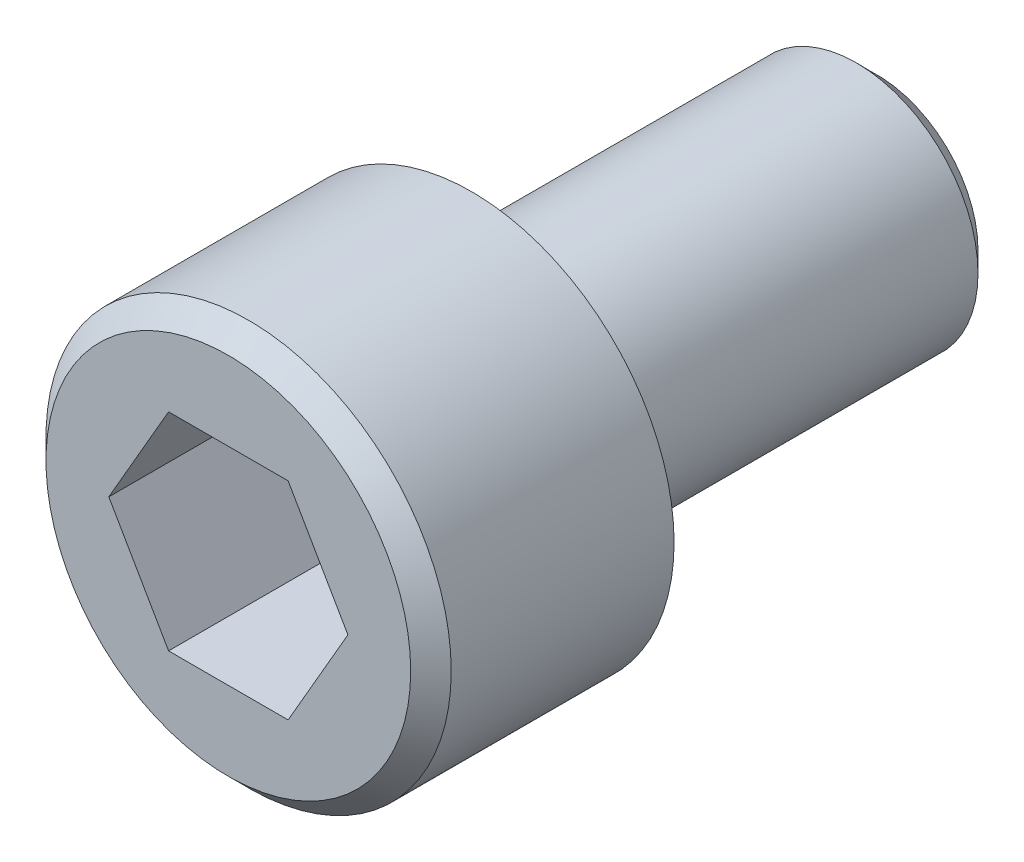
from build123d import *

# Parameters (mm, degrees)
CROQUIS1_R              = 5
SALIENTE_EXTRUIR1_DEPTH = 6
CROQUIS2_R              = 3
SALIENTE_EXTRUIR2_DEPTH = 10
CHAFL_N1_SIZE           = 0.5
CORTAR_EXTRUIR1_DEPTH   = 4


with BuildPart() as part:
    # Croquis1 → Saliente-Extruir1 (new body)
    with BuildSketch(Plane.XY):
        Circle(CROQUIS1_R)
    extrude(amount=SALIENTE_EXTRUIR1_DEPTH)

    # Croquis2 → Saliente-Extruir2 (add)
    with BuildSketch(Plane(origin=(0, 0, 0), x_dir=(-1, 0, 0), z_dir=(0, 0, -1))):
        with Locations(Location((0, 0, 0), (0, 0, 180))):
            Circle(CROQUIS2_R)
    extrude(amount=SALIENTE_EXTRUIR2_DEPTH)

    # Chaflán1
    chafl_n1_edges = [part.edges().sort_by_distance(p)[0] for p in [
        (-5, 0, 6),
        (-3, 0, -10),
    ]]
    chamfer(chafl_n1_edges, length=CHAFL_N1_SIZE)

    # Croquis3 → Cortar-Extruir1 (cut)
    with BuildSketch(Plane.XY.offset(6)):
        Polygon((2.95, 0), (1.475, 2.554774941), (-1.475, 2.554774941), (-2.95, 0), (-1.475, -2.554774941), (1.475, -2.554774941), align=None)
    extrude(amount=-CORTAR_EXTRUIR1_DEPTH, mode=Mode.SUBTRACT)


solid = part.part
